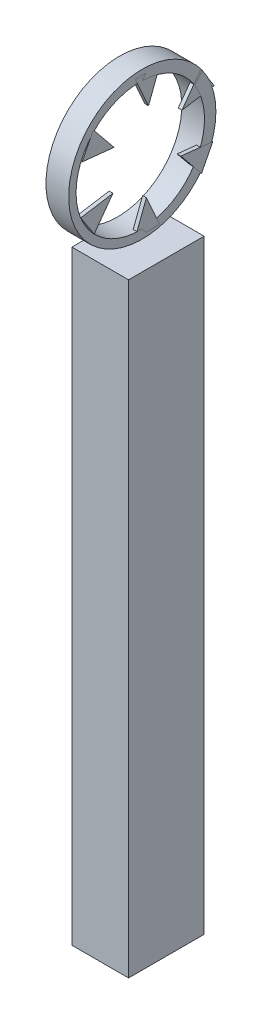
from build123d import *

# Parameters (mm, degrees)
SKETCH1_W             = 19.05
SKETCH1_H             = 203.2
BOSS_EXTRUDE1_DEPTH   = 25.4
SKETCH3_R             = 24.743349468
BOSS_EXTRUDE2_DEPTH   = 7.62
SKETCH4_R             = 21.578734867
CUT_EXTRUDE1_DEPTH    = 25.4
BOSS_EXTRUDE3_DEPTH   = 1.27
BOSS_EXTRUDE3_2_DEPTH = 1.27
BOSS_EXTRUDE3_3_DEPTH = 1.27
BOSS_EXTRUDE3_4_DEPTH = 1.27
BOSS_EXTRUDE3_5_DEPTH = 1.27
BOSS_EXTRUDE3_6_DEPTH = 1.27


with BuildPart() as part:
    # Sketch1 → Boss-Extrude1 (new body)
    with BuildSketch(Plane.XY):
        with Locations((9.525, -101.6)):
            Rectangle(SKETCH1_W, SKETCH1_H)
    extrude(amount=BOSS_EXTRUDE1_DEPTH)


with BuildPart() as body_2:
    # Sketch3 → Boss-Extrude2 (new body)
    with BuildSketch(Plane.ZY.offset(-9.525)):
        with Locations(Location((11.266756012, 24.743349468, 0), (0, 0, 180))):
            Circle(SKETCH3_R)
    extrude(amount=BOSS_EXTRUDE2_DEPTH)

    # Sketch4 → Cut-Extrude1 (cut)
    with BuildSketch(Plane.ZY.offset(-1.905)):
        with Locations((11.943841143, 24.571829641)):
            Circle(SKETCH4_R)
    extrude(amount=-CUT_EXTRUDE1_DEPTH, mode=Mode.SUBTRACT)


with BuildPart() as body_3:
    # Sketch5 → Boss-Extrude3 (new body)
    with BuildSketch(Plane.ZY.offset(-9.525)):
        Polygon((31.973200377, 16.542722148), (21.118827786, 18.284910257), (27.436601801, 9.551304828), align=None)
    extrude(amount=BOSS_EXTRUDE3_DEPTH)


with BuildPart() as body_4:
    # Sketch5 → Boss-Extrude3 2 (new body)
    with BuildSketch(Plane.ZY.offset(-9.525)):
        Polygon((13.79568913, 1.116564099), (9.877281995, 11.387820559), (5.472644835, 1.549665052), align=None)
    extrude(amount=BOSS_EXTRUDE3_2_DEPTH)


with BuildPart() as body_5:
    # Sketch5 → Boss-Extrude3 3 (new body)
    with BuildSketch(Plane.ZY.offset(-9.525)):
        Polygon((-8.652511246, 9.145671591), (-1.716545791, 17.674739943), (-12.438956966, 16.570189865), align=None)
    extrude(amount=BOSS_EXTRUDE3_3_DEPTH)


with BuildPart() as body_6:
    # Sketch5 → Boss-Extrude3 4 (new body)
    with BuildSketch(Plane.ZY.offset(-9.525)):
        Polygon((-12.923200377, 32.600937133), (-2.068827786, 30.858749025), (-8.386601801, 39.592354453), align=None)
    extrude(amount=BOSS_EXTRUDE3_4_DEPTH)


with BuildPart() as body_7:
    # Sketch5 → Boss-Extrude3 5 (new body)
    with BuildSketch(Plane.ZY.offset(-9.525)):
        Polygon((5.25431087, 48.027095182), (9.172718005, 37.755838723), (13.577355165, 47.593994229), align=None)
    extrude(amount=BOSS_EXTRUDE3_5_DEPTH)


with BuildPart() as body_8:
    # Sketch5 → Boss-Extrude3 6 (new body)
    with BuildSketch(Plane.ZY.offset(-9.525)):
        Polygon((27.702511246, 39.99798769), (20.766545791, 31.468919339), (31.488956966, 32.573469417), align=None)
    extrude(amount=BOSS_EXTRUDE3_6_DEPTH)


solid = Compound([part.part, body_2.part, body_3.part, body_4.part, body_5.part, body_6.part, body_7.part, body_8.part])
